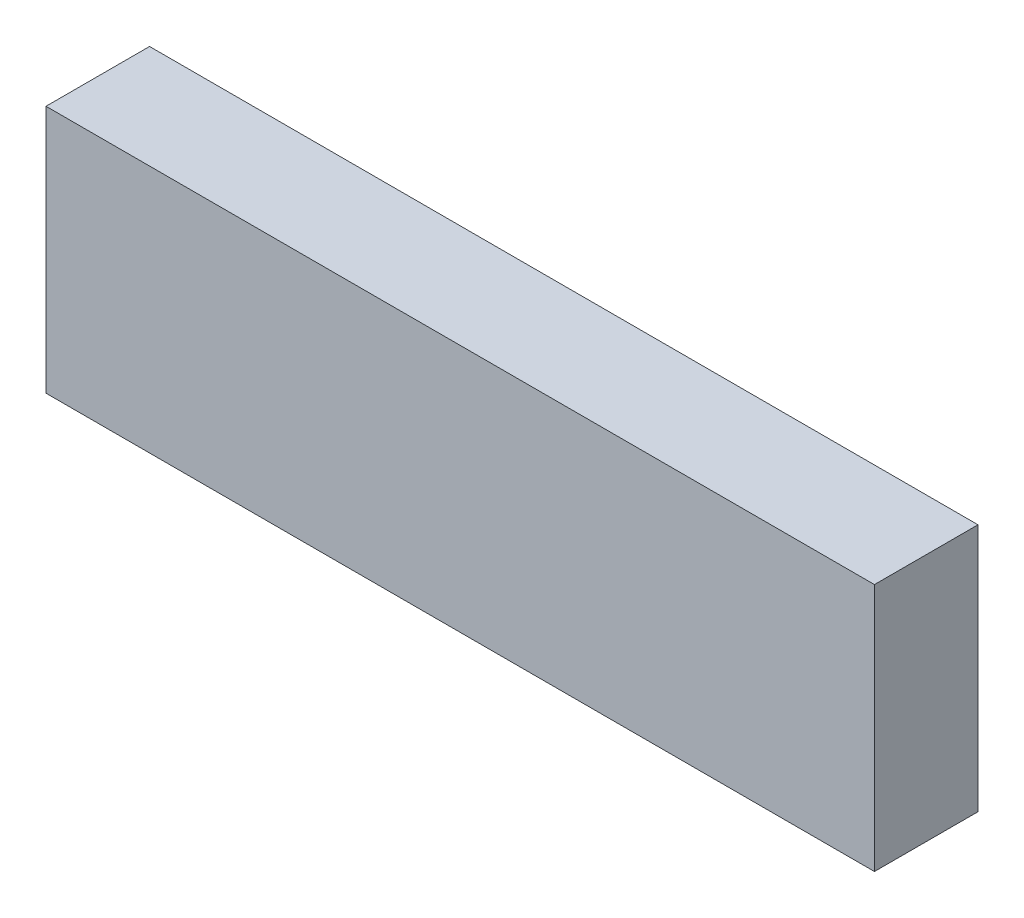
from build123d import *

# Parameters (mm, degrees)
ESBO_O1_W                = 40
ESBO_O1_H                = 12
RESSALTO_EXTRUS_O1_DEPTH = 5


with BuildPart() as part:
    # Esboço1 → Ressalto-extrusão1 (new body)
    with BuildSketch(Plane.XY):
        with Locations((20, 6)):
            Rectangle(ESBO_O1_W, ESBO_O1_H)
    extrude(amount=RESSALTO_EXTRUS_O1_DEPTH)


solid = part.part
